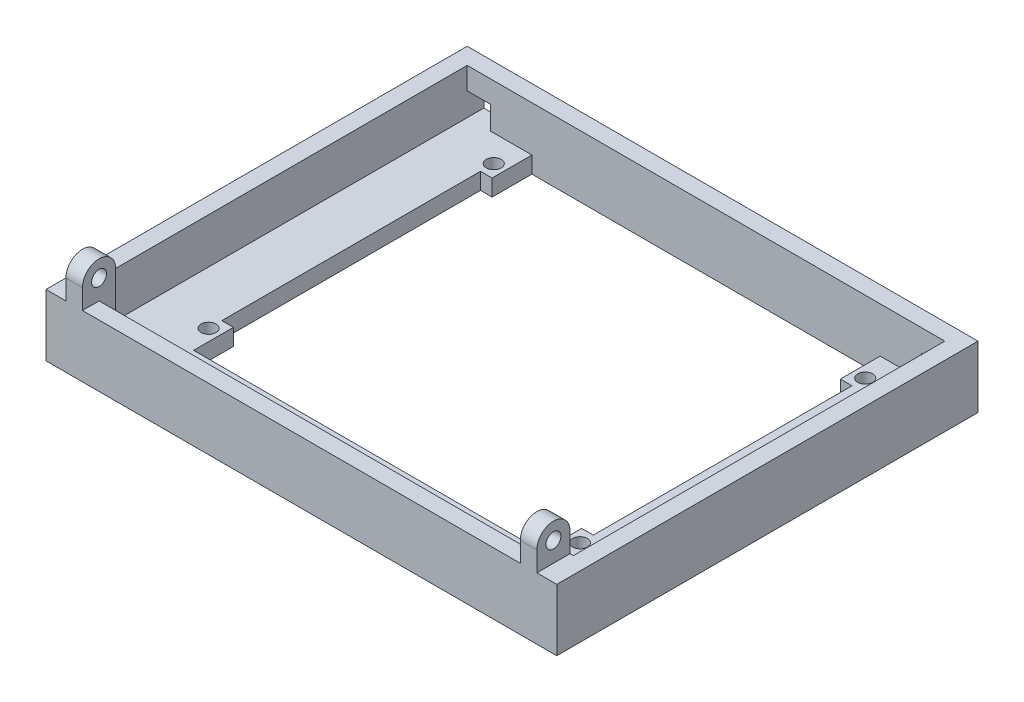
from build123d import *

# Parameters (mm, degrees)
SKETCH1_W           = 154
SKETCH1_H           = 127
SKETCH1_R           = 2.25
BOSS_EXTRUDE1_DEPTH = 5
SKETCH2_R           = 2.25
BOSS_EXTRUDE2_DEPTH = 11
SKETCH4_W           = 6
SKETCH4_H           = 10
CUT_EXTRUDE1_DEPTH  = 37
SKETCH5_W           = 132
SKETCH5_H           = 5
SKETCH5_W_2         = 1
SKETCH5_W_3         = 6
BOSS_EXTRUDE3_DEPTH = 13.65
SKETCH6_W           = 7
SKETCH6_H           = 7
CUT_EXTRUDE2_DEPTH  = 13.65


with BuildPart() as part:
    # Sketch1 → Boss-Extrude1 (new body)
    with BuildSketch(Plane(origin=(0, 0, 0), x_dir=(1, 0, 0), z_dir=(0, 1, 0))):
        with Locations((0, -7.5)):
            Rectangle(SKETCH1_W, SKETCH1_H)
        with Locations(Location((-56, -43, 0), (0, 0, 270))):
            Circle(SKETCH1_R, mode=Mode.SUBTRACT)
        with Locations(Location((56, -43, 0), (0, 0, 270))):
            Circle(SKETCH1_R, mode=Mode.SUBTRACT)
        with Locations(Location((-56, 43, 0), (0, 0, 270))):
            Circle(SKETCH1_R, mode=Mode.SUBTRACT)
        Polygon((52.5, -39), (52.5, -51), (-52.5, -51), (-52.5, -39), (-56, -39), (-56, 39), (-52.5, 39), (-52.5, 51), (52.5, 51), (52.5, 39), (56, 39), (56, -39), align=None, mode=Mode.SUBTRACT)
        with Locations(Location((56, 43, 0), (0, 0, 270))):
            Circle(SKETCH1_R, mode=Mode.SUBTRACT)
    extrude(amount=BOSS_EXTRUDE1_DEPTH)

    # Sketch2 → Boss-Extrude2 (add)
    with BuildSketch(Plane.ZY.offset(77)):
        with BuildLine():
            ThreePointArc((71, 24.65), (66, 29.65), (61, 24.65))
            Line((61, 24.65), (61, 5))
            Line((61, 5), (71, 5))
            Line((71, 5), (71, 24.65))
        make_face()
        with Locations((66, 24.65)):
            Circle(SKETCH2_R, mode=Mode.SUBTRACT)
    boss_extrude2 = extrude(amount=-BOSS_EXTRUDE2_DEPTH)

    # Sketch4 → Cut-Extrude1 (cut)
    with BuildSketch(Plane(origin=(0, 5, 0), x_dir=(1, 0, 0), z_dir=(0, 1, 0))):
        with Locations((-74, -66)):
            Rectangle(SKETCH4_W, SKETCH4_H)
    cut_extrude1 = extrude(amount=CUT_EXTRUDE1_DEPTH, mode=Mode.SUBTRACT)

    # Mirror1: Boss-Extrude2, Cut-Extrude1 across plane
    add(boss_extrude2.mirror(Plane(origin=(0, 0, 0), x_dir=(0, 0, 1), z_dir=(1, 0, 0))))
    add(cut_extrude1.mirror(Plane(origin=(0, 0, 0), x_dir=(0, 0, 1), z_dir=(1, 0, 0))), mode=Mode.SUBTRACT)

    # Sketch5 → Boss-Extrude3 (add)
    with BuildSketch(Plane(origin=(0, 5, 0), x_dir=(1, 0, 0), z_dir=(0, 1, 0))):
        Polygon((71, -71), (77, -71), (77, 56), (-77, 56), (-77, -71), (-71, -71), (-71, -66), (-72, -66), (-72, -61), (-72, 51), (-52.5, 51), (52.5, 51), (72, 51), (72, -61), (72, -66), (71, -66), align=None)
        with Locations((0, -68.5)):
            Rectangle(SKETCH5_W, SKETCH5_H)
        with Locations((71.5, -63.5)):
            Rectangle(SKETCH5_W_2, SKETCH5_H)
        with Locations((-69, -63.5)):
            Rectangle(SKETCH5_W_3, SKETCH5_H)
    extrude(amount=BOSS_EXTRUDE3_DEPTH)

    # Sketch6 → Cut-Extrude2 (cut)
    with BuildSketch(Plane.XY.offset(-51)):
        with Locations((68.5, 8.5)):
            Rectangle(SKETCH6_W, SKETCH6_H)
    cut_extrude2 = extrude(amount=-CUT_EXTRUDE2_DEPTH, mode=Mode.SUBTRACT)

    # Mirror2: Cut-Extrude2 across plane
    add(cut_extrude2.mirror(Plane(origin=(0, 0, 0), x_dir=(0, 0, 1), z_dir=(1, 0, 0))), mode=Mode.SUBTRACT)


solid = part.part
